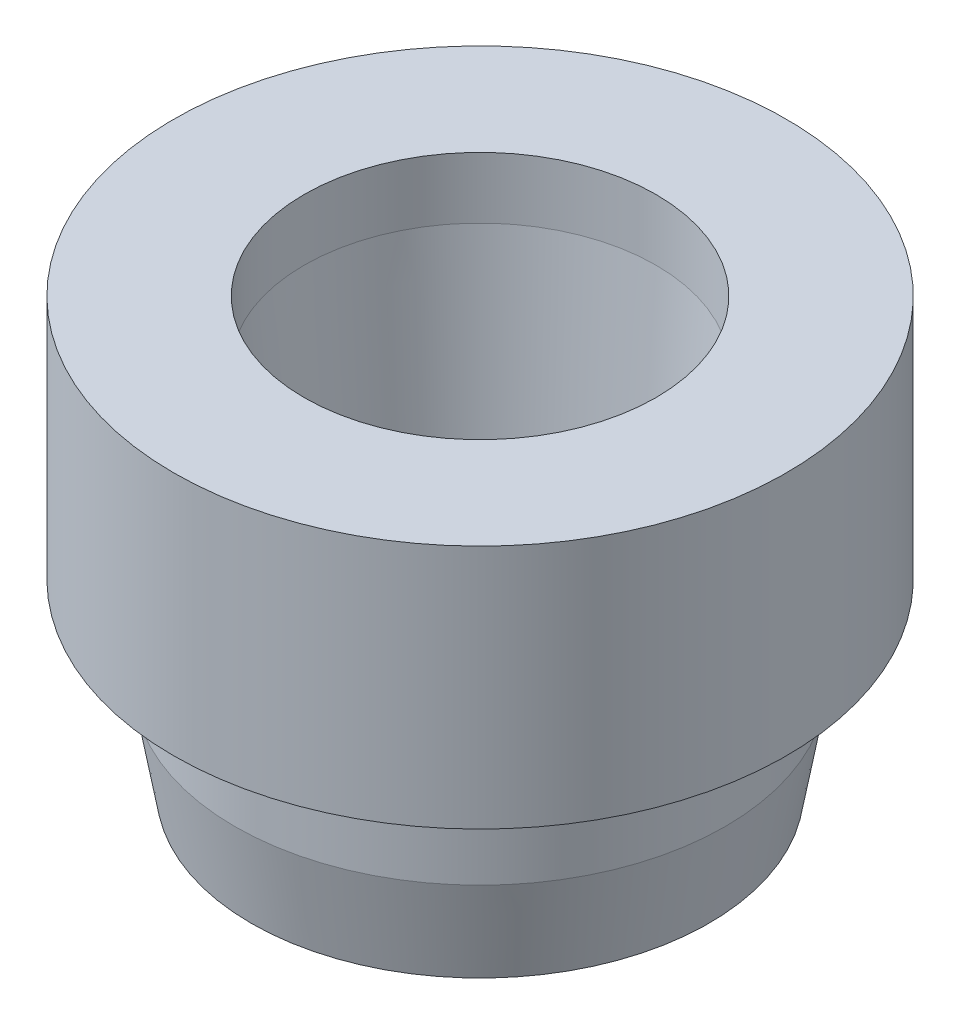
from build123d import *


with BuildPart() as part:
    # Szkic1 → Obrót1 (revolve)
    with BuildSketch(Plane.XY, mode=Mode.PRIVATE) as obr_t1_sk:
        Polygon((-28.72, 46.880116473), (-28.72, 36.880116473), (-24.697095519, -13.119883527), (-24.697095519, -23.119883527), (-37.355095289, -23.119883527), (-40, -8.119883527), (-40, 6.880116473), (-50, 6.880116473), (-50, 46.880116473), align=None)
    revolve(obr_t1_sk.sketch.rotate(Axis((0, 46.880116473, 0), (0, -1, 0)), 270), axis=Axis((0, 46.880116473, 0), (0, -1, 0)))


solid = part.part
